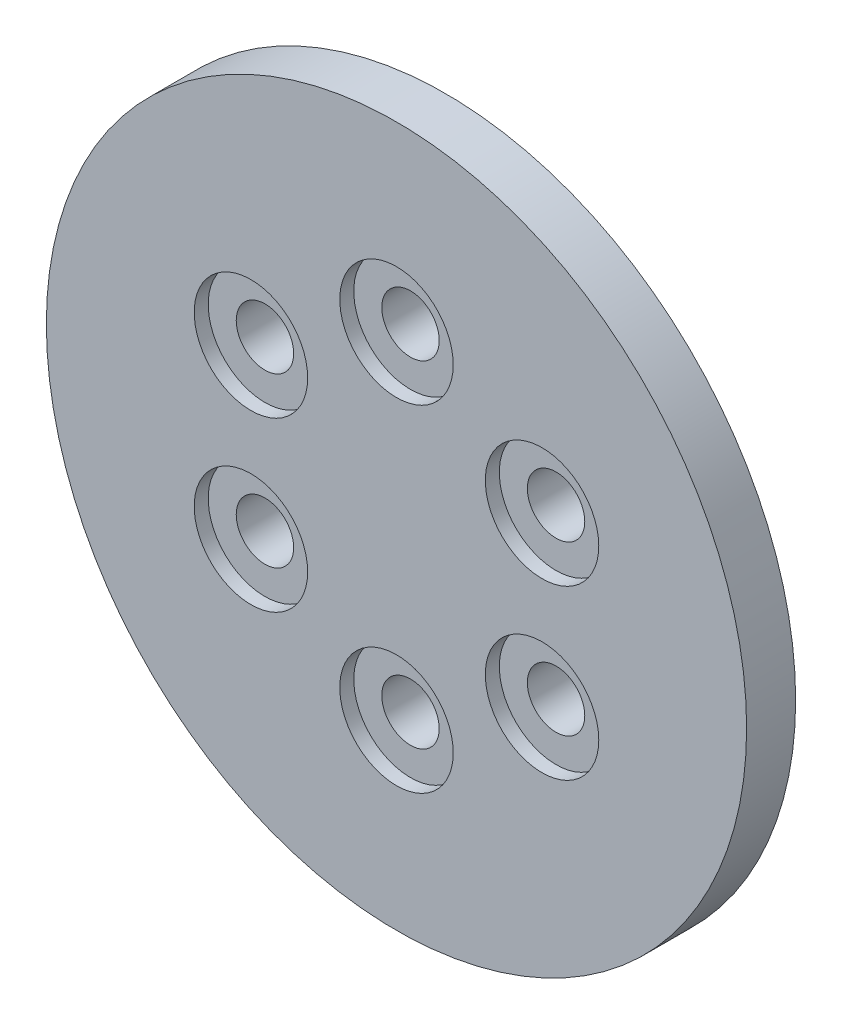
from build123d import *

# Parameters (mm, degrees)
SKETCH_1_R          = 25
EXTRUDE_1_DEPTH     = 4
SKETCH_4_R          = 2.05
CUT_EXTRUDE_1_DEPTH = 10
CUT_EXTRUDE_START   = -1
SKETCH_5_R          = 4.05
SKETCH_5_R_2        = 2.05
CUT_EXTRUDE_2_DEPTH = 1
SKETCH_6_R          = 25
SKETCH_6_R_2        = 20
CUT_EXTRUDE_3_DEPTH = 0.5


with BuildPart() as part:
    # 草图1 → 凸台-拉伸1 (new body)
    with BuildSketch(Plane.XY):
        Circle(SKETCH_1_R)
    extrude(amount=EXTRUDE_1_DEPTH)

    # 草图4 → 切除-拉伸1 (cut)
    with BuildSketch(Plane(origin=(0, 0, 0), x_dir=(-1, 0, 0), z_dir=(0, 0, -1))):
        with Locations((-10.392304845, -6)):
            Circle(SKETCH_4_R)
        with Locations((-10.392304845, 6)):
            Circle(SKETCH_4_R)
        with Locations((0, 12)):
            Circle(SKETCH_4_R)
        with Locations((10.392304845, 6)):
            Circle(SKETCH_4_R)
        with Locations((10.392304845, -6)):
            Circle(SKETCH_4_R)
        with Locations((0, -12)):
            Circle(SKETCH_4_R)
    extrude(amount=-CUT_EXTRUDE_1_DEPTH, mode=Mode.SUBTRACT)

    # 草图5 → 切除-拉伸2 (cut)
    # profile 1 of 6: a face of its own
    with BuildSketch(Plane.XY.offset(4).offset(CUT_EXTRUDE_START)):
        with Locations((-10.392304845, 6)):
            Circle(SKETCH_5_R)
        with Locations(Location((-10.392304845, 6, 0), (0, 0, 180))):
            Circle(SKETCH_5_R_2, mode=Mode.SUBTRACT)
    # profile 2 of 6: a face of its own
    with BuildSketch(Plane.XY.offset(4).offset(CUT_EXTRUDE_START)):
        with Locations((-10.392304845, -6)):
            Circle(SKETCH_5_R)
        with Locations(Location((-10.392304845, -6, 0), (0, 0, 180))):
            Circle(SKETCH_5_R_2, mode=Mode.SUBTRACT)
    # profile 3 of 6: a face of its own
    with BuildSketch(Plane.XY.offset(4).offset(CUT_EXTRUDE_START)):
        with Locations((0, -12)):
            Circle(SKETCH_5_R)
        with Locations(Location((0, -12, 0), (0, 0, 180))):
            Circle(SKETCH_5_R_2, mode=Mode.SUBTRACT)
    # profile 4 of 6: a face of its own
    with BuildSketch(Plane.XY.offset(4).offset(CUT_EXTRUDE_START)):
        with Locations((10.392304845, -6)):
            Circle(SKETCH_5_R)
        with Locations(Location((10.392304845, -6, 0), (0, 0, 180))):
            Circle(SKETCH_5_R_2, mode=Mode.SUBTRACT)
    # profile 5 of 6: a face of its own
    with BuildSketch(Plane.XY.offset(4).offset(CUT_EXTRUDE_START)):
        with Locations((10.392304845, 6)):
            Circle(SKETCH_5_R)
        with Locations(Location((10.392304845, 6, 0), (0, 0, 180))):
            Circle(SKETCH_5_R_2, mode=Mode.SUBTRACT)
    # profile 6 of 6: a face of its own
    with BuildSketch(Plane.XY.offset(4).offset(CUT_EXTRUDE_START)):
        with Locations((0, 12)):
            Circle(SKETCH_5_R)
        with Locations(Location((0, 12, 0), (0, 0, 180))):
            Circle(SKETCH_5_R_2, mode=Mode.SUBTRACT)
    extrude(amount=CUT_EXTRUDE_2_DEPTH, mode=Mode.SUBTRACT)

    # 草图6 → 切除-拉伸3 (cut)
    with BuildSketch(Plane(origin=(0, 0, 0), x_dir=(-1, 0, 0), z_dir=(0, 0, -1))):
        Circle(SKETCH_6_R)
        Circle(SKETCH_6_R_2, mode=Mode.SUBTRACT)
    extrude(amount=-CUT_EXTRUDE_3_DEPTH, mode=Mode.SUBTRACT)


solid = part.part
